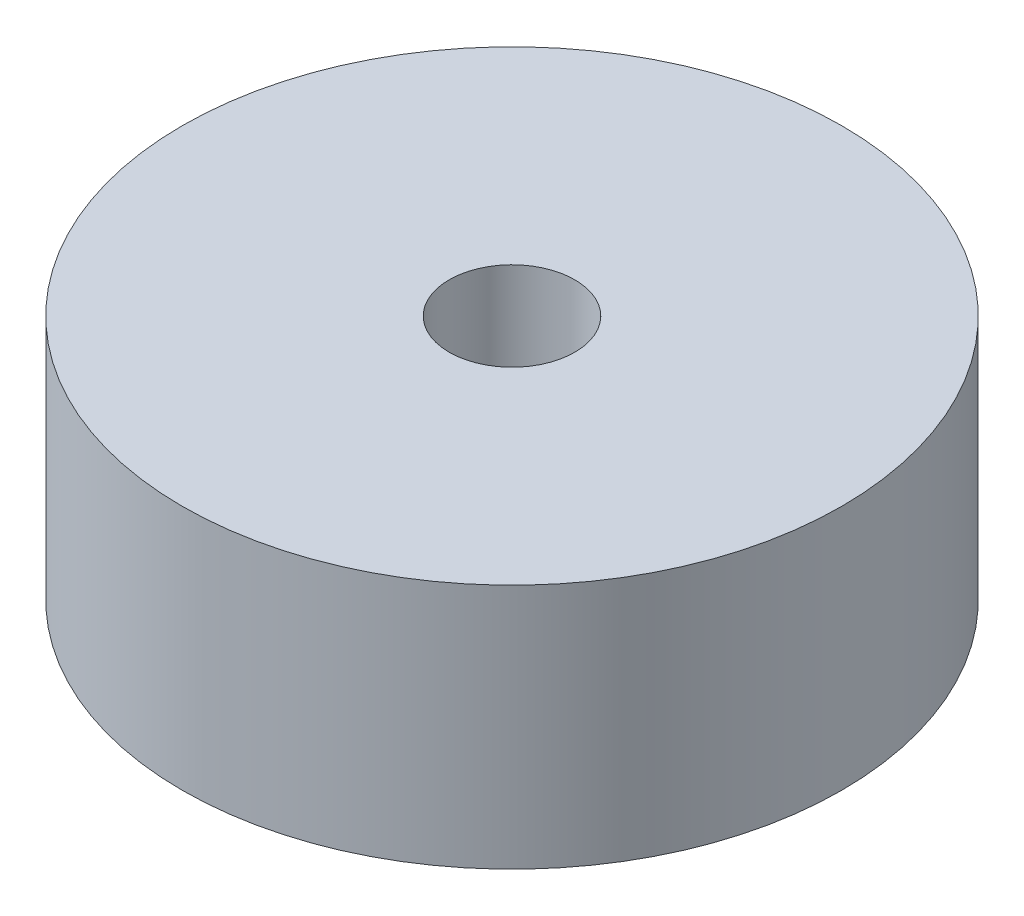
from build123d import *

# Parameters (mm, degrees)
SKETCH1_R           = 31.5
BOSS_EXTRUDE1_DEPTH = 23.5
SKETCH2_R           = 6
CUT_EXTRUDE1_DEPTH  = 23.5


with BuildPart() as part:
    # Sketch1 → Boss-Extrude1 (new body)
    with BuildSketch(Plane(origin=(0, 0, 0), x_dir=(1, 0, 0), z_dir=(0, 1, 0))):
        with Locations(Location((0, 0, 0), (0, 0, 270))):
            Circle(SKETCH1_R)
    extrude(amount=BOSS_EXTRUDE1_DEPTH)

    # Sketch2 → Cut-Extrude1 (cut)
    with BuildSketch(Plane(origin=(0, 23.5, 0), x_dir=(1, 0, 0), z_dir=(0, 1, 0))):
        with Locations(Location((0, 0, 0), (0, 0, 270))):
            Circle(SKETCH2_R)
    extrude(amount=-CUT_EXTRUDE1_DEPTH, mode=Mode.SUBTRACT)


solid = part.part
